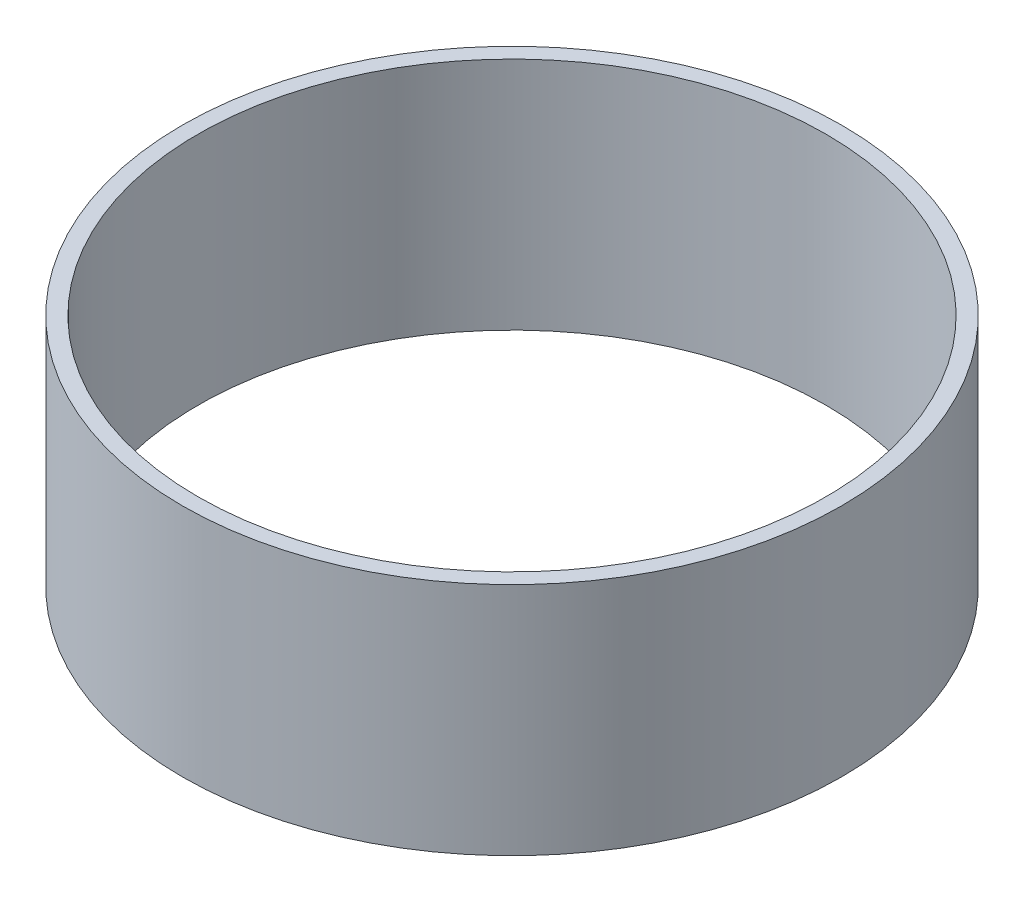
from build123d import *

# Parameters (mm, degrees)
SKETCH3_R           = 21.066
SKETCH3_R_2         = 20.066
BOSS_EXTRUDE2_DEPTH = 15


with BuildPart() as part:
    # Sketch3 → Boss-Extrude2 (new body)
    with BuildSketch(Plane(origin=(0, 0, 0), x_dir=(1, 0, 0), z_dir=(0, 1, 0))):
        with Locations(Location((0, 0, 0), (0, 0, 270))):
            Circle(SKETCH3_R)
        with Locations(Location((0, 0, 0), (0, 0, 270))):
            Circle(SKETCH3_R_2, mode=Mode.SUBTRACT)
    extrude(amount=BOSS_EXTRUDE2_DEPTH)


solid = part.part
